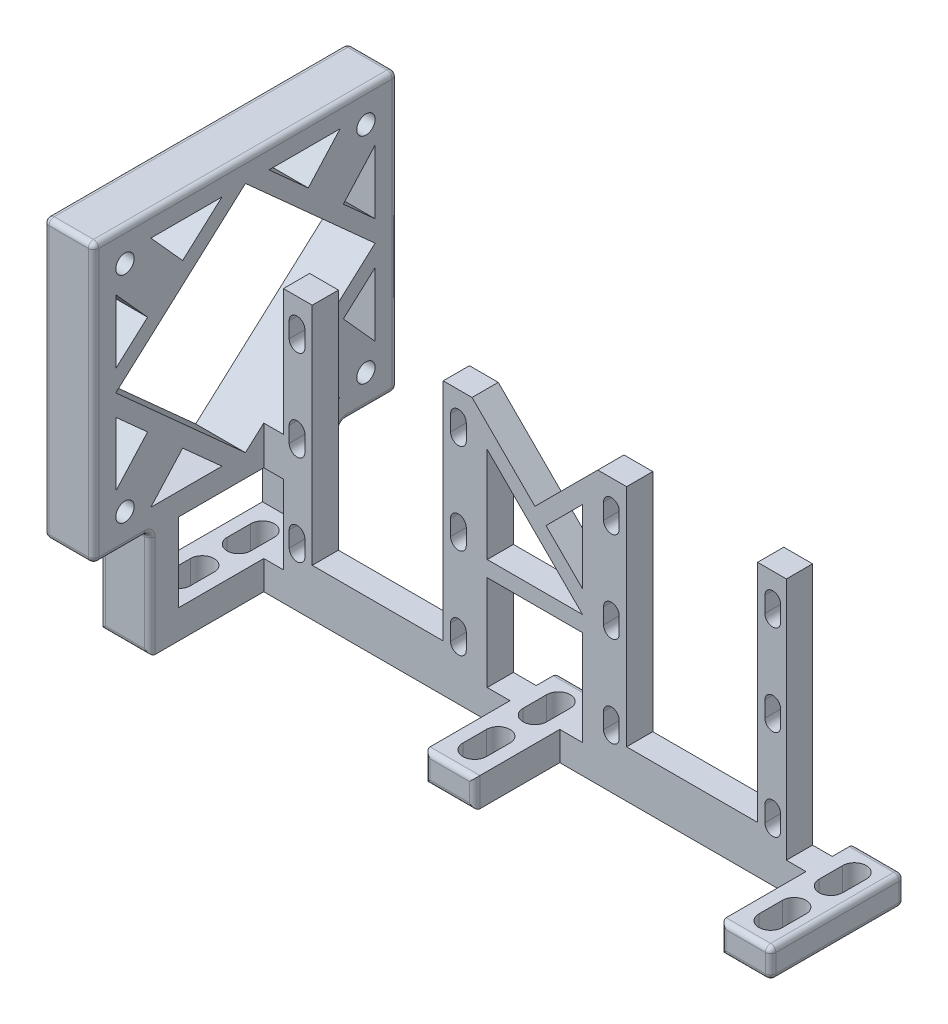
from build123d import *

# Parameters (mm, degrees)
BOSS_EXTRU_1_DEPTH = 5
ESQUISSE2_W        = 9.5
ESQUISSE2_H        = 25.5
BOSS_EXTRU_2_DEPTH = 5.5
ESQUISSE3_R        = 1.75
BOSS_EXTRU_3_DEPTH = 9.5
CONG_1_R           = 1
BOSS_EXTRU_4_REACH = 141.92


with BuildPart() as part:
    # Esquisse1 → Boss.-Extru.1 (new body)
    with BuildSketch(Plane.XY):
        Polygon((5.5, 52), (5.5, 9), (30.5, 9), (30.5, 52), (36, 52), (48, 40), (60, 52), (65.5, 52), (65.5, 9), (90.5, 9), (90.5, 52), (96, 52), (96, 0), (50.25, 0), (50.25, 5.5), (57.1, 5.5), (57.1, 23.657359313), (38.9, 23.657359313), (38.9, 5.5), (45.75, 5.5), (45.75, 0), (0, 0), (0, 52), align=None)
        Polygon((57.1, 44.857359313), (50.121320344, 37.878679656), (57.1, 30.9), align=None, mode=Mode.SUBTRACT)
        Polygon((38.9, 44.857359313), (57.1, 26.657359313), (38.9, 26.657359313), align=None, mode=Mode.SUBTRACT)
        with BuildLine():
            Line((4.1, 12.65), (4.1, 9.65))
            ThreePointArc((4.1, 9.65), (2.6, 8.15), (1.1, 9.65))
            Line((1.1, 9.65), (1.1, 12.65))
            ThreePointArc((1.1, 12.65), (2.6, 14.15), (4.1, 12.65))
        make_face(mode=Mode.SUBTRACT)
        with BuildLine():
            Line((4.1, 29.95), (4.1, 26.95))
            ThreePointArc((4.1, 26.95), (2.6, 25.45), (1.1, 26.95))
            Line((1.1, 26.95), (1.1, 29.95))
            ThreePointArc((1.1, 29.95), (2.6, 31.45), (4.1, 29.95))
        make_face(mode=Mode.SUBTRACT)
        with BuildLine():
            Line((4.1, 47.25), (4.1, 44.25))
            ThreePointArc((4.1, 44.25), (2.6, 42.75), (1.1, 44.25))
            Line((1.1, 44.25), (1.1, 47.25))
            ThreePointArc((1.1, 47.25), (2.6, 48.75), (4.1, 47.25))
        make_face(mode=Mode.SUBTRACT)
        with BuildLine():
            Line((31.9, 47.25), (31.9, 44.25))
            ThreePointArc((31.9, 44.25), (33.4, 42.75), (34.9, 44.25))
            Line((34.9, 44.25), (34.9, 47.25))
            ThreePointArc((34.9, 47.25), (33.4, 48.75), (31.9, 47.25))
        make_face(mode=Mode.SUBTRACT)
        with BuildLine():
            Line((31.9, 29.95), (31.9, 26.95))
            ThreePointArc((31.9, 26.95), (33.4, 25.45), (34.9, 26.95))
            Line((34.9, 26.95), (34.9, 29.95))
            ThreePointArc((34.9, 29.95), (33.4, 31.45), (31.9, 29.95))
        make_face(mode=Mode.SUBTRACT)
        with BuildLine():
            Line((31.9, 12.65), (31.9, 9.65))
            ThreePointArc((31.9, 9.65), (33.4, 8.15), (34.9, 9.65))
            Line((34.9, 9.65), (34.9, 12.65))
            ThreePointArc((34.9, 12.65), (33.4, 14.15), (31.9, 12.65))
        make_face(mode=Mode.SUBTRACT)
        with BuildLine():
            Line((91.9, 12.65), (91.9, 9.65))
            ThreePointArc((91.9, 9.65), (93.4, 8.15), (94.9, 9.65))
            Line((94.9, 9.65), (94.9, 12.65))
            ThreePointArc((94.9, 12.65), (93.4, 14.15), (91.9, 12.65))
        make_face(mode=Mode.SUBTRACT)
        with BuildLine():
            Line((91.9, 29.95), (91.9, 26.95))
            ThreePointArc((91.9, 26.95), (93.4, 25.45), (94.9, 26.95))
            Line((94.9, 26.95), (94.9, 29.95))
            ThreePointArc((94.9, 29.95), (93.4, 31.45), (91.9, 29.95))
        make_face(mode=Mode.SUBTRACT)
        with BuildLine():
            Line((91.9, 47.25), (91.9, 44.25))
            ThreePointArc((91.9, 44.25), (93.4, 42.75), (94.9, 44.25))
            Line((94.9, 44.25), (94.9, 47.25))
            ThreePointArc((94.9, 47.25), (93.4, 48.75), (91.9, 47.25))
        make_face(mode=Mode.SUBTRACT)
        with BuildLine():
            Line((64.1, 47.25), (64.1, 44.25))
            ThreePointArc((64.1, 44.25), (62.6, 42.75), (61.1, 44.25))
            Line((61.1, 44.25), (61.1, 47.25))
            ThreePointArc((61.1, 47.25), (62.6, 48.75), (64.1, 47.25))
        make_face(mode=Mode.SUBTRACT)
        with BuildLine():
            Line((64.1, 29.95), (64.1, 26.95))
            ThreePointArc((64.1, 26.95), (62.6, 25.45), (61.1, 26.95))
            Line((61.1, 26.95), (61.1, 29.95))
            ThreePointArc((61.1, 29.95), (62.6, 31.45), (64.1, 29.95))
        make_face(mode=Mode.SUBTRACT)
        with BuildLine():
            Line((64.1, 12.65), (64.1, 9.65))
            ThreePointArc((64.1, 9.65), (62.6, 8.15), (61.1, 9.65))
            Line((61.1, 9.65), (61.1, 12.65))
            ThreePointArc((61.1, 12.65), (62.6, 14.15), (64.1, 12.65))
        make_face(mode=Mode.SUBTRACT)
    extrude(amount=BOSS_EXTRU_1_DEPTH)

    # Esquisse2 → Boss.-Extru.2 (add)
    # profile 1 of 3: a face of its own
    with BuildSketch(Plane.XZ):
        Polygon((-13.25, -4.25), (-3.75, -4.25), (-3.75, 0), (0, 0), (0, 5), (-3.75, 5), (-3.75, 21.25), (-13.25, 21.25), align=None)
        with BuildLine():
            Line((-10.75, 0.5), (-10.75, 5))
            ThreePointArc((-10.75, 5), (-8.5, 7.25), (-6.25, 5))
            Line((-6.25, 5), (-6.25, 0.5))
            ThreePointArc((-6.25, 0.5), (-8.5, -1.75), (-10.75, 0.5))
        make_face(mode=Mode.SUBTRACT)
        with BuildLine():
            Line((-10.75, 12), (-10.75, 16.5))
            ThreePointArc((-10.75, 16.5), (-8.5, 18.75), (-6.25, 16.5))
            Line((-6.25, 16.5), (-6.25, 12))
            ThreePointArc((-6.25, 12), (-8.5, 9.75), (-10.75, 12))
        make_face(mode=Mode.SUBTRACT)
    # profile 2 of 3: a face of its own
    with BuildSketch(Plane.XZ):
        with Locations((48, 8.5)):
            Rectangle(ESQUISSE2_W, ESQUISSE2_H)
        with BuildLine():
            Line((50.25, 12), (50.25, 16.5))
            ThreePointArc((50.25, 16.5), (48, 18.75), (45.75, 16.5))
            Line((45.75, 16.5), (45.75, 12))
            ThreePointArc((45.75, 12), (48, 9.75), (50.25, 12))
        make_face(mode=Mode.SUBTRACT)
        with BuildLine():
            Line((50.25, 0.5), (50.25, 5))
            ThreePointArc((50.25, 5), (48, 7.25), (45.75, 5))
            Line((45.75, 5), (45.75, 0.5))
            ThreePointArc((45.75, 0.5), (48, -1.75), (50.25, 0.5))
        make_face(mode=Mode.SUBTRACT)
    # profile 3 of 3: a face of its own
    with BuildSketch(Plane.XZ):
        Polygon((109.25, 21.25), (99.75, 21.25), (99.75, 5), (96, 5), (96, 0), (99.75, 0), (99.75, -4.25), (109.25, -4.25), align=None)
        with BuildLine():
            Line((102.25, 12), (102.25, 16.5))
            ThreePointArc((102.25, 16.5), (104.5, 18.75), (106.75, 16.5))
            Line((106.75, 16.5), (106.75, 12))
            ThreePointArc((106.75, 12), (104.5, 9.75), (102.25, 12))
        make_face(mode=Mode.SUBTRACT)
        with BuildLine():
            Line((102.25, 0.5), (102.25, 5))
            ThreePointArc((102.25, 5), (104.5, 7.25), (106.75, 5))
            Line((106.75, 5), (106.75, 0.5))
            ThreePointArc((106.75, 0.5), (104.5, -1.75), (102.25, 0.5))
        make_face(mode=Mode.SUBTRACT)
    extrude(amount=-BOSS_EXTRU_2_DEPTH)

    # Esquisse3 → Boss.-Extru.3 (add)
    with BuildSketch(Plane(origin=(-3.75, 0, 0), x_dir=(0, 0, -1), z_dir=(1, 0, 0))):
        Polygon((20.5, 20.5), (20.5, 73.5), (-37.5, 73.5), (-37.5, 20.5), (-26.75, 20.5), (-26.75, 0), (-21.25, 0), (-21.25, 20.5), (4.25, 20.5), (4.25, 0), (9.75, 0), (9.75, 20.5), align=None)
        with Locations((-31.5, 67.5)):
            Circle(ESQUISSE3_R, mode=Mode.SUBTRACT)
        with Locations((14.5, 67.5)):
            Circle(ESQUISSE3_R, mode=Mode.SUBTRACT)
        with Locations((14.5, 26.5)):
            Circle(ESQUISSE3_R, mode=Mode.SUBTRACT)
        with Locations((-31.5, 26.5)):
            Circle(ESQUISSE3_R, mode=Mode.SUBTRACT)
        Polygon((-8.5, 69.25), (-33.25, 47), (-8.5, 24.75), (16.25, 47), align=None, mode=Mode.SUBTRACT)
        Polygon((-12.987325922, 69.25), (-26.556992095, 69.25), (-20.491913337, 62.503451718), align=None, mode=Mode.SUBTRACT)
        Polygon((-33.25, 51.034060677), (-27.184921241, 56.486505218), (-33.25, 63.2330535), align=None, mode=Mode.SUBTRACT)
        Polygon((-4.012674078, 69.25), (3.491913337, 62.503451718), (9.556992095, 69.25), align=None, mode=Mode.SUBTRACT)
        Polygon((16.25, 63.2330535), (16.25, 51.034060677), (10.184921241, 56.486505218), align=None, mode=Mode.SUBTRACT)
        Polygon((10.184921241, 37.513494782), (16.25, 30.7669465), (16.25, 42.965939323), align=None, mode=Mode.SUBTRACT)
        Polygon((3.491913337, 31.496548282), (9.556992095, 24.75), (-4.012674078, 24.75), align=None, mode=Mode.SUBTRACT)
        Polygon((-26.556992095, 24.75), (-20.491913337, 31.496548282), (-12.987325922, 24.75), align=None, mode=Mode.SUBTRACT)
        Polygon((-27.184921241, 37.513494782), (-33.25, 30.7669465), (-33.25, 42.965939323), align=None, mode=Mode.SUBTRACT)
    extrude(amount=-BOSS_EXTRU_3_DEPTH)

    # Congé1
    cong_1_edges = [part.edges().sort_by_distance(p)[0] for p in [
        (48, 0, 21.25),
        (48, 5.5, 21.25),
        (52.75, 2.75, 21.25),
        (52.75, 2.75, -4.25),
        (43.25, 2.75, 21.25),
        (43.25, 2.75, -4.25),
        (48, 0, -4.25),
        (48, 5.5, -4.25),
        (99.75, 2.75, 21.25),
        (99.75, 2.75, -4.25),
        (109.25, 2.75, -4.25),
        (109.25, 2.75, 21.25),
        (109.25, 0, 8.5),
        (104.5, 0, 21.25),
        (104.5, 0, -4.25),
        (109.25, 5.5, 8.5),
        (104.5, 5.5, -4.25),
        (104.5, 5.5, 21.25),
        (-13.25, 20.5, -15.125),
        (-8.5, 20.5, -20.5),
        (-13.25, 10.25, -9.75),
        (-8.5, 20.5, -9.75),
        (-8.5, 0, -9.75),
        (-13.25, 10.25, 26.75),
        (-8.5, 0, 26.75),
        (-13.25, 20.5, 32.125),
        (-8.5, 20.5, 26.75),
        (-13.25, 47, 37.5),
        (-8.5, 20.5, 37.5),
        (-13.25, 73.5, 8.5),
        (-8.5, 73.5, 37.5),
        (-13.25, 47, -20.5),
        (-8.5, 73.5, -20.5),
        (-3.75, 20.5, -15.125),
        (-3.75, 47, -20.5),
        (-3.75, 73.5, 8.5),
        (-3.75, 47, 37.5),
        (-3.75, 20.5, 32.125),
        (-3.75, 10.25, 26.75),
        (-3.75, 10.25, -9.75),
    ]]
    fillet(cong_1_edges, radius=CONG_1_R)

    # Esquisse4 → Boss.-Extru.4 (add, up to next)
    with BuildSketch(Plane(origin=(-3.75, 0, 0), x_dir=(0, 0, -1), z_dir=(1, 0, 0)), mode=Mode.PRIVATE) as boss_extru_4_sk1:
        Polygon((0, 20.5), (0, 24.75), (-4.012674078, 24.75), (0, 28.357353464), (0, 32.391414141), (-5, 27.896464646), (-5, 20.5), align=None)
    boss_extru_4_tool1 = extrude(boss_extru_4_sk1.sketch, amount=BOSS_EXTRU_4_REACH, mode=Mode.PRIVATE) - part.part
    add(boss_extru_4_tool1.solids().sort_by_distance((-3.75, 22.625, 0.128998))[0])


solid = part.part
